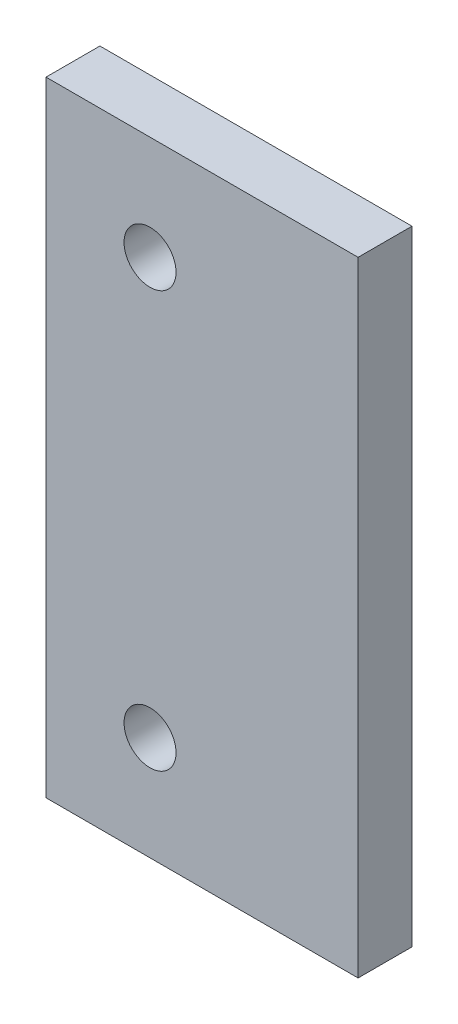
from build123d import *

# Parameters (mm, degrees)
SKETCH1_W                  = 38.1
SKETCH1_H                  = 76.2
BOSS_EXTRUDE1_DEPTH        = 6.5786
F_97_0_25_DIAMETER_HOLE1_D = 6.35


with BuildPart() as part:
    # Sketch1 → Boss-Extrude1 (new body)
    with BuildSketch(Plane.XY):
        Rectangle(SKETCH1_W, SKETCH1_H)
    extrude(amount=BOSS_EXTRUDE1_DEPTH)

    # #97 (0.25) Diameter Hole1 (through all)
    with Locations(Plane(origin=(-6.35, 25.4, 6.5786), x_dir=(1, 0, 0), z_dir=(0, 0, 1))):
        with Locations((0, 0), (0, -50.8)):
            Hole(F_97_0_25_DIAMETER_HOLE1_D / 2)


solid = part.part
